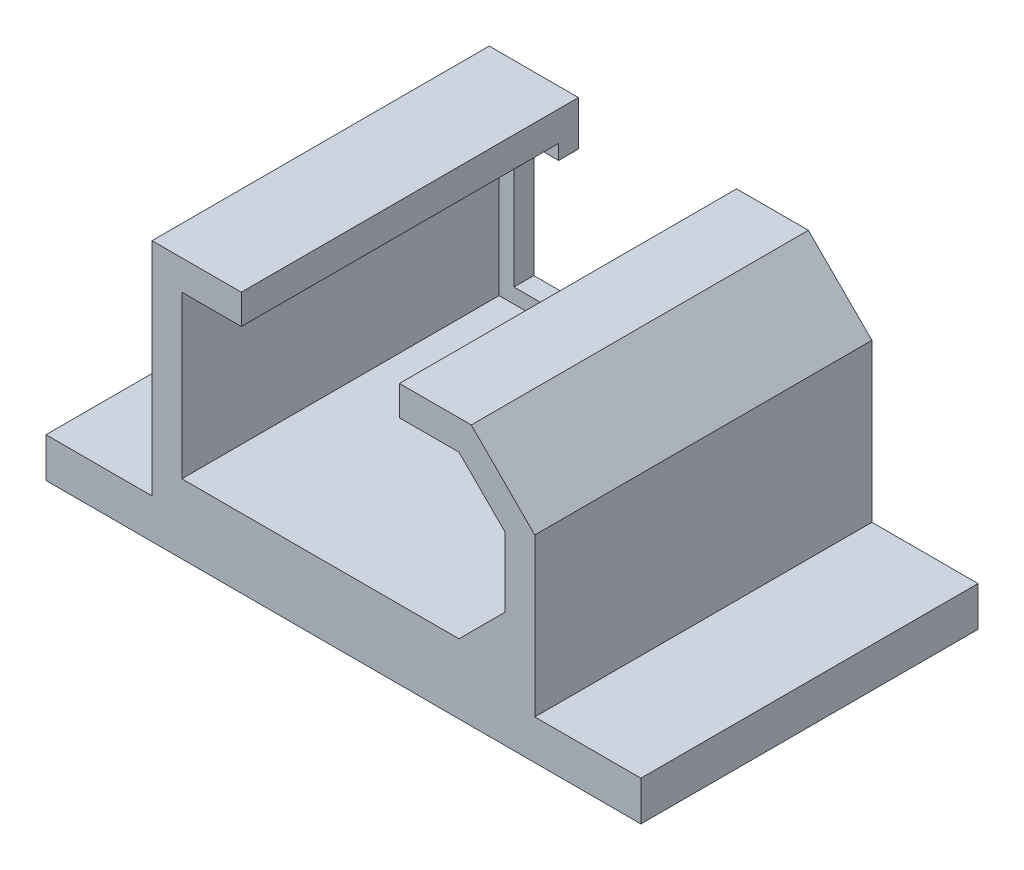
from build123d import *

# Parameters (mm, degrees)
EXTRUDE_1285_DEPTH = 17
EXTRUDE_1381_DEPTH = 1


with BuildPart() as part:
    # Sketch 270 → Extrude 1285 (new body)
    with BuildSketch(Plane.XY):
        Polygon((9.85, 13.15), (5.35, 13.15), (5.35, 2), (0, 2), (0, 0), (30, 0), (30, 2), (24.65, 2), (24.65, 9.946320344), (21.446320344, 13.15), (17.825, 13.15), (17.825, 11.65), (20.825, 11.65), (23.15, 9.325), (23.15, 5.825), (20.825, 3.5), (6.85, 3.5), (6.85, 11.65), (9.85, 11.65), align=None)
    extrude(amount=EXTRUDE_1285_DEPTH)

    # Эскиз1<6> → Extrude 1381 (add)
    with BuildSketch(Plane.XY):
        Polygon((9.85, 10.9), (9.85, 11.65), (6.85, 11.65), (6.85, 3.5), (20.825, 3.5), (23.15, 5.825), (23.15, 9.325), (20.825, 11.65), (17.825, 11.65), (17.825, 10.9), (20.514339828, 10.9), (22.4, 9.014339828), (22.4, 6.135660172), (20.514339828, 4.25), (7.6, 4.25), (7.6, 10.9), align=None)
    extrude(amount=EXTRUDE_1381_DEPTH)


solid = part.part
